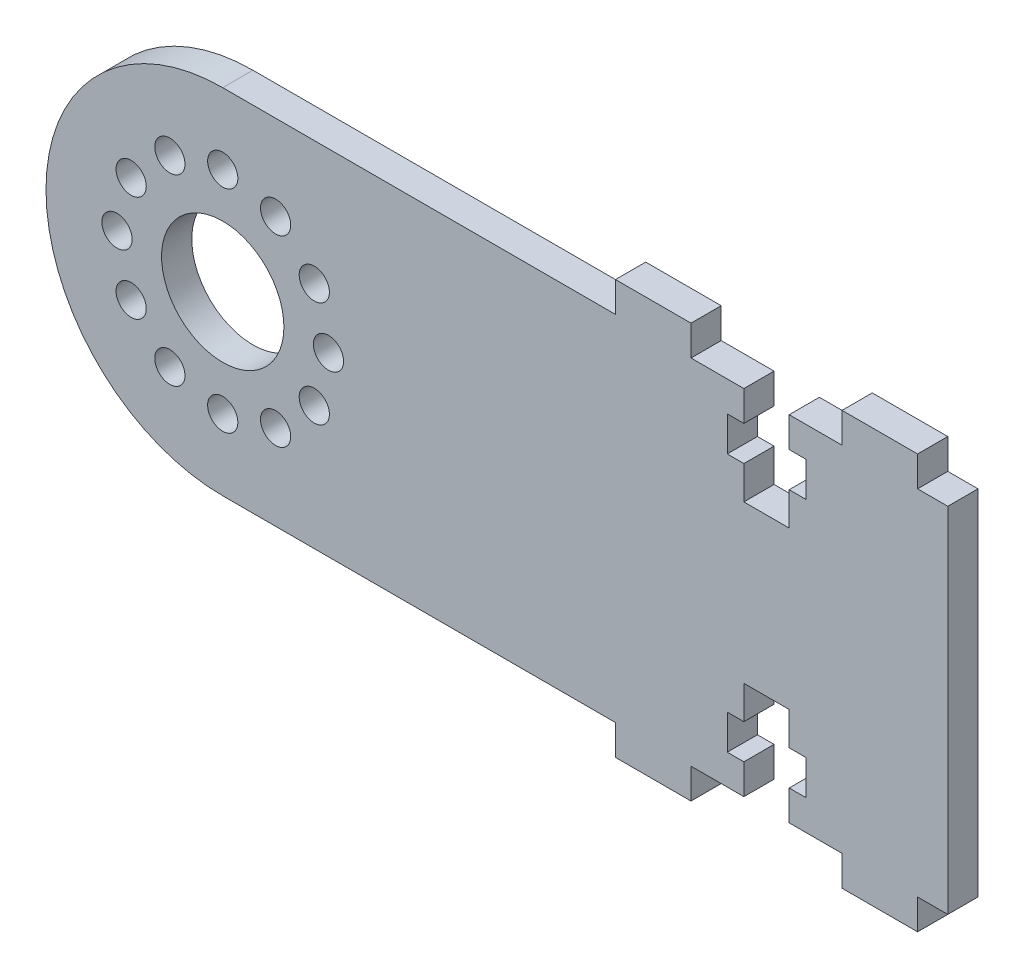
from build123d import *

# Parameters (mm, degrees)
SKETCH1_R           = 4.05
SKETCH1_R_2         = 1
BOSS_EXTRUDE1_DEPTH = 2


with BuildPart() as part:
    # Sketch1 → Boss-Extrude1 (new body)
    with BuildSketch(Plane.XY):
        with BuildLine():
            Line((48, 11.7), (48, -11.7))
            Line((48, -11.7), (46, -11.7))
            Line((46, -11.7), (46, -13.7))
            Line((46, -13.7), (41, -13.7))
            Line((41, -13.7), (41, -11.7))
            Line((41, -11.7), (37.5, -11.7))
            Line((37.5, -11.7), (37.5, -9.7))
            Line((37.5, -9.7), (38.6, -9.7))
            Line((38.6, -9.7), (38.6, -7.4))
            Line((38.6, -7.4), (37.5, -7.4))
            Line((37.5, -7.4), (37.5, -5.2))
            Line((37.5, -5.2), (34.5, -5.2))
            Line((34.5, -5.2), (34.5, -7.4))
            Line((34.5, -7.4), (33.4, -7.4))
            Line((33.4, -7.4), (33.4, -9.7))
            Line((33.4, -9.7), (34.5, -9.7))
            Line((34.5, -9.7), (34.5, -11.7))
            Line((34.5, -11.7), (31, -11.7))
            Line((31, -11.7), (31, -13.7))
            Line((31, -13.7), (26, -13.7))
            Line((26, -13.7), (26, -11.7))
            Line((26, -11.7), (0, -11.7))
            ThreePointArc((0, -11.7), (-11.7, 0), (0, 11.7))
            Line((0, 11.7), (26, 11.7))
            Line((26, 11.7), (26, 13.7))
            Line((26, 13.7), (31, 13.7))
            Line((31, 13.7), (31, 11.7))
            Line((31, 11.7), (34.5, 11.7))
            Line((34.5, 11.7), (34.5, 9.7))
            Line((34.5, 9.7), (33.4, 9.7))
            Line((33.4, 9.7), (33.4, 7.4))
            Line((33.4, 7.4), (34.5, 7.4))
            Line((34.5, 7.4), (34.5, 5.2))
            Line((34.5, 5.2), (37.5, 5.2))
            Line((37.5, 5.2), (37.5, 7.4))
            Line((37.5, 7.4), (38.6, 7.4))
            Line((38.6, 7.4), (38.6, 9.7))
            Line((38.6, 9.7), (37.5, 9.7))
            Line((37.5, 9.7), (37.5, 11.7))
            Line((37.5, 11.7), (41, 11.7))
            Line((41, 11.7), (41, 13.7))
            Line((41, 13.7), (46, 13.7))
            Line((46, 13.7), (46, 11.7))
            Line((46, 11.7), (48, 11.7))
        make_face()
        Circle(SKETCH1_R, mode=Mode.SUBTRACT)
        with Locations((7, 0)):
            Circle(SKETCH1_R_2, mode=Mode.SUBTRACT)
        with Locations((6.062177826, -3.5)):
            Circle(SKETCH1_R_2, mode=Mode.SUBTRACT)
        with Locations((3.5, -6.062177826)):
            Circle(SKETCH1_R_2, mode=Mode.SUBTRACT)
        with Locations((0, -7)):
            Circle(SKETCH1_R_2, mode=Mode.SUBTRACT)
        with Locations((-3.5, -6.062177826)):
            Circle(SKETCH1_R_2, mode=Mode.SUBTRACT)
        with Locations((-6.062177826, -3.5)):
            Circle(SKETCH1_R_2, mode=Mode.SUBTRACT)
        with Locations((-7, 0)):
            Circle(SKETCH1_R_2, mode=Mode.SUBTRACT)
        with Locations((-6.062177826, 3.5)):
            Circle(SKETCH1_R_2, mode=Mode.SUBTRACT)
        with Locations((-3.5, 6.062177826)):
            Circle(SKETCH1_R_2, mode=Mode.SUBTRACT)
        with Locations((0, 7)):
            Circle(SKETCH1_R_2, mode=Mode.SUBTRACT)
        with Locations((3.5, 6.062177826)):
            Circle(SKETCH1_R_2, mode=Mode.SUBTRACT)
        with Locations((6.062177826, 3.5)):
            Circle(SKETCH1_R_2, mode=Mode.SUBTRACT)
    extrude(amount=BOSS_EXTRUDE1_DEPTH)


solid = part.part
